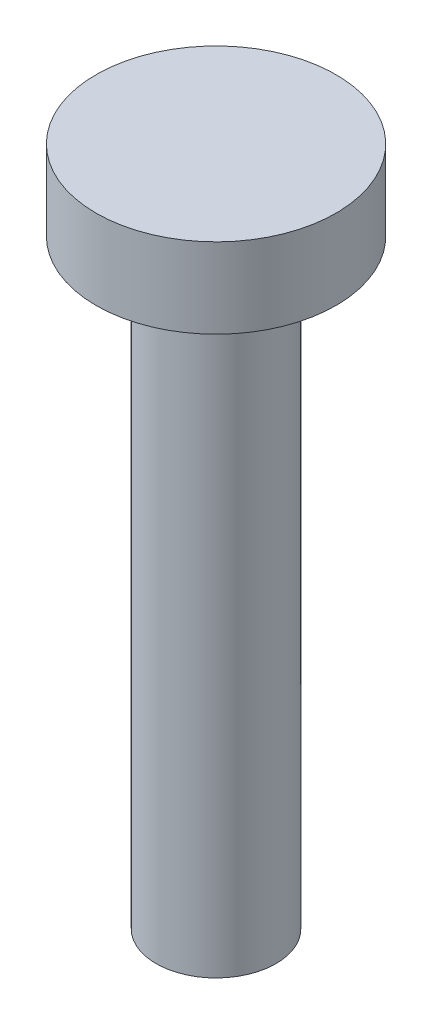
from build123d import *

# Parameters (mm, degrees)
ESQUISSE2_R        = 30
BOSS_EXTRU_2_DEPTH = 20
ESQUISSE3_R        = 15
BOSS_EXTRU_3_DEPTH = 150


with BuildPart() as part:
    # Esquisse2 → Boss.-Extru.2 (new body)
    with BuildSketch(Plane(origin=(0, 0, 0), x_dir=(1, 0, 0), z_dir=(0, 1, 0))):
        with Locations(Location((0, 0, 0), (0, 0, 270))):
            Circle(ESQUISSE2_R)
    extrude(amount=BOSS_EXTRU_2_DEPTH)

    # Esquisse3 → Boss.-Extru.3 (add)
    with BuildSketch(Plane.XZ):
        with Locations(Location((0, 0, 0), (0, 0, 270))):
            Circle(ESQUISSE3_R)
    extrude(amount=BOSS_EXTRU_3_DEPTH)


solid = part.part
